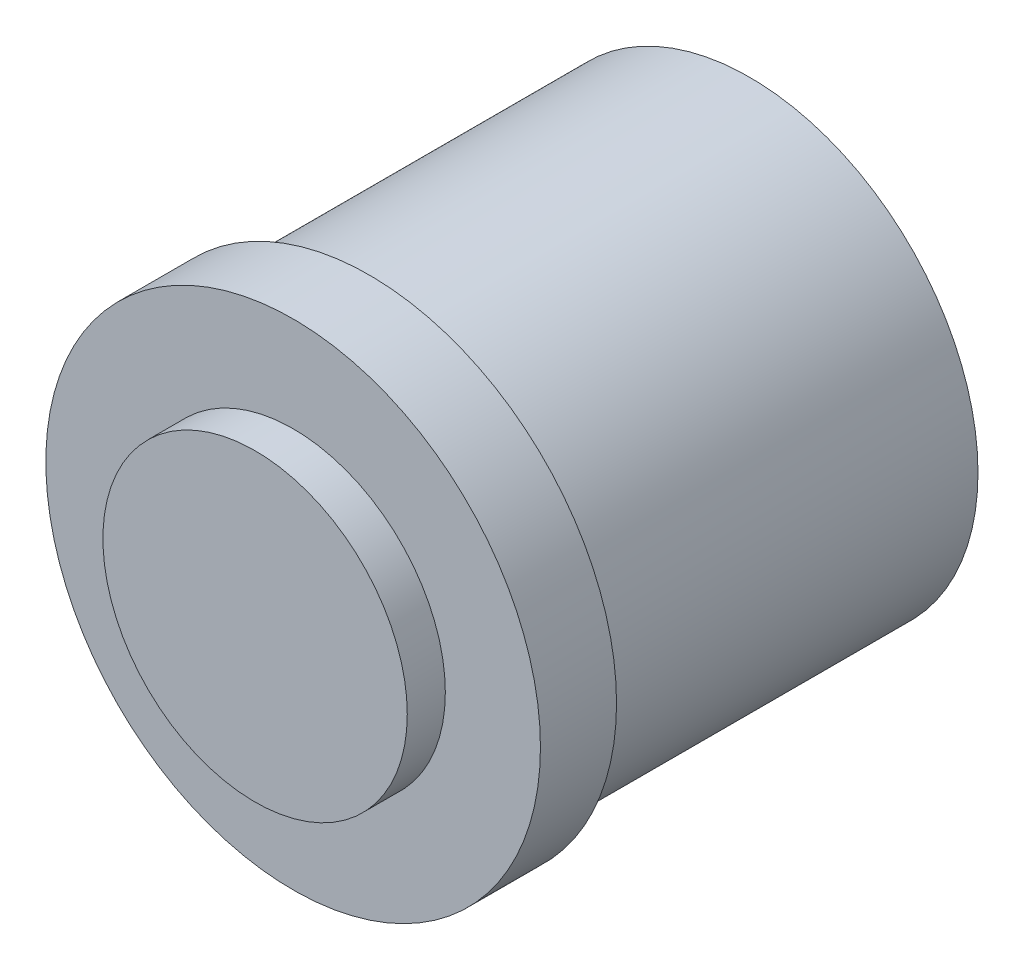
from build123d import *

# Parameters (mm, degrees)
SKETCH1_R           = 38.1
BOSS_EXTRUDE1_DEPTH = 63.5
SKETCH2_R           = 41.275
BOSS_EXTRUDE2_DEPTH = 12.7
SKETCH3_R           = 25.4
BOSS_EXTRUDE3_DEPTH = 6.35


with BuildPart() as part:
    # Sketch1 → Boss-Extrude1 (new body)
    with BuildSketch(Plane.XY):
        Circle(SKETCH1_R)
    extrude(amount=BOSS_EXTRUDE1_DEPTH)

    # Sketch2 → Boss-Extrude2 (add)
    with BuildSketch(Plane.XY.offset(63.5)):
        Circle(SKETCH2_R)
    extrude(amount=BOSS_EXTRUDE2_DEPTH)

    # Sketch3 → Boss-Extrude3 (add)
    with BuildSketch(Plane.XY.offset(76.2)):
        Circle(SKETCH3_R)
    extrude(amount=BOSS_EXTRUDE3_DEPTH)


solid = part.part
